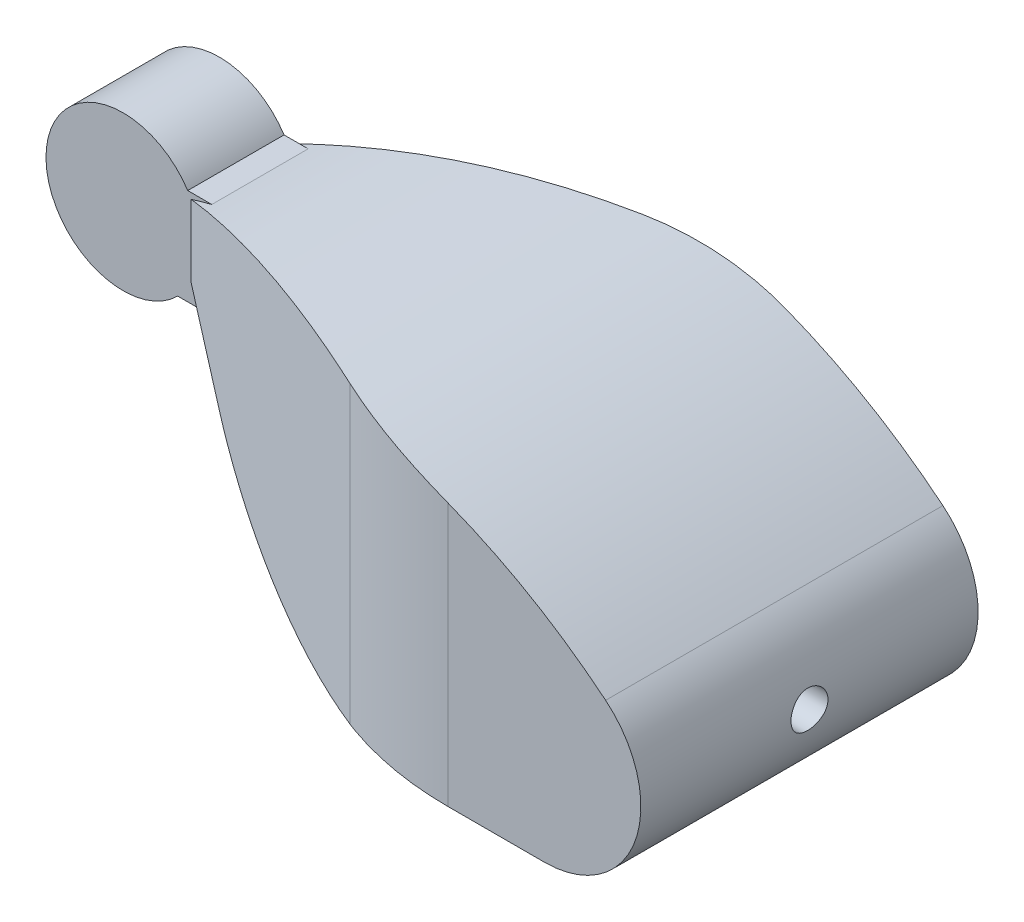
from build123d import *

# Parameters (mm, degrees)
BOSS_EXTRUDE1_DEPTH             = 6.35
BOSS_EXTRUDE3_START             = -7.9375
BOSS_EXTRUDE3_DEPTH             = 22.225
CUT_EXTRUDE4_DEPTH              = 48.173062372
CUT_EXTRUDE4_DEPTH_BACK         = 48.173062372
CUT_EXTRUDE10_START             = -19.05
SKETCH16_W                      = 4.7625
SKETCH16_H                      = 4.7625
CUT_EXTRUDE10_DEPTH             = 33.703711112
CUT_EXTRUDE11_REACH             = 48.31
CUT_EXTRUDE11_DIRECTION_2_REACH = 48.31
F_2_CLEARANCE_HOLE1_D           = 2.4384
BOSS_EXTRUDE19_START            = -6.35
BOSS_EXTRUDE19_DEPTH            = 6.35
CUT_EXTRUDE12_DEPTH             = 4.7625
CUT_EXTRUDE12_DEPTH_BACK        = 4.7625
CUT_EXTRUDE13_DEPTH             = 3.175
CUT_EXTRUDE14_START             = 9.525
CUT_EXTRUDE14_DEPTH             = 3.175


with BuildPart() as part:
    # Sketch2 → Boss-Extrude1 (new body)
    with BuildSketch(Plane.XY):
        with BuildLine():
            Line((4.487320853, -2.38125), (4.487320853, 2.38125))
            ThreePointArc((4.487320853, 2.38125), (-5.08, 0), (4.487320853, -2.38125))
        make_face()
    extrude(amount=BOSS_EXTRUDE1_DEPTH)

    # Sketch3 → Boss-Extrude3 (add)
    with BuildSketch(Plane.XY.offset(BOSS_EXTRUDE3_START)):
        with BuildLine():
            Line((4.487320853, 2.38125), (4.487320853, -2.38125))
            Line((4.487320853, -2.38125), (7.464780529, -7.539384784))
            ThreePointArc((7.464780529, -7.539384784), (13.566062361, -13.641452925), (21.901057446, -15.875))
            Line((21.901057446, -15.875), (35.711259281, -15.875))
            ThreePointArc((35.711259281, -15.875), (41.690195135, -11.663884303), (39.7390552, -4.615890098))
            ThreePointArc((39.7390552, -4.615890098), (22.990060642, 3.300382048), (4.487320853, 2.38125))
        make_face()
    extrude(amount=BOSS_EXTRUDE3_DEPTH)

    # Sketch14 → Cut-Extrude4 (cut, two sides: drawn at the far end of the back side and taken through both)
    with BuildSketch(Plane(origin=(0, 0, 0), x_dir=(1, 0, 0), z_dir=(0, 1, 0)).offset(-CUT_EXTRUDE4_DEPTH_BACK)):
        with BuildLine():
            Line((4.487320853, -6.35), (21.428093277, -12.823412845))
            ThreePointArc((21.428093277, -12.823412845), (25.327691566, -13.918413536), (29.361259281, -14.2875))
            Line((29.361259281, -14.2875), (4.487320853, -14.2875))
            Line((4.487320853, -14.2875), (4.487320853, -6.35))
        make_face()
        with BuildLine():
            Line((4.487320853, 0), (21.428093277, 6.473412845))
            ThreePointArc((21.428093277, 6.473412845), (25.327691566, 7.568413536), (29.361259281, 7.9375))
            Line((29.361259281, 7.9375), (4.487320853, 7.9375))
            Line((4.487320853, 7.9375), (4.487320853, 0))
        make_face()
    extrude(amount=CUT_EXTRUDE4_DEPTH + CUT_EXTRUDE4_DEPTH_BACK, mode=Mode.SUBTRACT)

    # Sketch16 → Cut-Extrude10 (cut, through all)
    with BuildSketch(Plane(origin=(42.061259281, 0, 0), x_dir=(0, 0, -1), z_dir=(1, 0, 0)).offset(CUT_EXTRUDE10_START)):
        with Locations((-3.175, -9.58215)):
            Rectangle(SKETCH16_W, SKETCH16_H)
    extrude(amount=-CUT_EXTRUDE10_DEPTH, mode=Mode.SUBTRACT)

    # Cut-Extrude11: up to this face of the body (flat: up to its plane)
    cut_extrude11_end = Plane(part.part.faces().sort_by_distance((15.949219939, -9.473187723, 5.55625))[0])
    # Sketch29 → Cut-Extrude11 (cut, up to the picked face)
    with BuildSketch(Plane(origin=(0, 0, 3.175), x_dir=(-1, 0, 0), z_dir=(0, 0, -1)), mode=Mode.PRIVATE) as cut_extrude11_sk1:
        Polygon((-7.269395019, -7.2009), (-23.011259281, -7.2009), (-6.432122374, -5.75041347), align=None)
    cut_extrude11_tool1 = split(extrude(cut_extrude11_sk1.sketch, amount=-CUT_EXTRUDE11_REACH, mode=Mode.PRIVATE), bisect_by=cut_extrude11_end, keep=Keep.BOTH, mode=Mode.PRIVATE)
    # Sketch29 → Cut-Extrude11 (cut, up to the picked face)
    with BuildSketch(Plane(origin=(0, 0, 3.175), x_dir=(-1, 0, 0), z_dir=(0, 0, -1)), mode=Mode.PRIVATE) as cut_extrude11_sk2:
        with BuildLine():
            Line((-23.011259281, -11.9634), (-13.549349632, -13.63178996))
            ThreePointArc((-13.549349632, -13.63178996), (-12.324513592, -12.849454696), (-11.172481099, -11.9634))
            Line((-11.172481099, -11.9634), (-23.011259281, -11.9634))
        make_face()
    cut_extrude11_tool2 = split(extrude(cut_extrude11_sk2.sketch, amount=-CUT_EXTRUDE11_REACH, mode=Mode.PRIVATE), bisect_by=cut_extrude11_end, keep=Keep.BOTH, mode=Mode.PRIVATE)
    add(cut_extrude11_tool1.solids().sort_by(Axis((12.237592, -6.717404, 3.175), (0, 0, 1)))[0], mode=Mode.SUBTRACT)
    add(cut_extrude11_tool2.solids().sort_by(Axis((15.867281, -12.523197, 3.175), (0, 0, 1)))[0], mode=Mode.SUBTRACT)

    # Cut-Extrude11 direction 2: up to this face of the body (flat: up to its plane)
    cut_extrude11_direction_2_end = Plane(part.part.faces().sort_by_distance((15.949219939, -9.473187723, 0.79375))[0])
    # Sketch29 → Cut-Extrude11 direction 2 (cut, up to the picked face)
    with BuildSketch(Plane(origin=(0, 0, 3.175), x_dir=(-1, 0, 0), z_dir=(0, 0, -1)), mode=Mode.PRIVATE) as cut_extrude11_direction_2_sk1:
        Polygon((-7.269395019, -7.2009), (-23.011259281, -7.2009), (-6.432122374, -5.75041347), align=None)
    cut_extrude11_direction_2_tool1 = split(extrude(cut_extrude11_direction_2_sk1.sketch, amount=CUT_EXTRUDE11_DIRECTION_2_REACH, mode=Mode.PRIVATE), bisect_by=cut_extrude11_direction_2_end, keep=Keep.BOTH, mode=Mode.PRIVATE)
    # Sketch29 → Cut-Extrude11 direction 2 (cut, up to the picked face)
    with BuildSketch(Plane(origin=(0, 0, 3.175), x_dir=(-1, 0, 0), z_dir=(0, 0, -1)), mode=Mode.PRIVATE) as cut_extrude11_direction_2_sk2:
        with BuildLine():
            Line((-23.011259281, -11.9634), (-13.549349632, -13.63178996))
            ThreePointArc((-13.549349632, -13.63178996), (-12.324513592, -12.849454696), (-11.172481099, -11.9634))
            Line((-11.172481099, -11.9634), (-23.011259281, -11.9634))
        make_face()
    cut_extrude11_direction_2_tool2 = split(extrude(cut_extrude11_direction_2_sk2.sketch, amount=CUT_EXTRUDE11_DIRECTION_2_REACH, mode=Mode.PRIVATE), bisect_by=cut_extrude11_direction_2_end, keep=Keep.BOTH, mode=Mode.PRIVATE)
    add(cut_extrude11_direction_2_tool1.solids().sort_by(Axis((12.237592, -6.717404, 3.175), (0, 0, -1)))[0], mode=Mode.SUBTRACT)
    add(cut_extrude11_direction_2_tool2.solids().sort_by(Axis((15.867281, -12.523197, 3.175), (0, 0, -1)))[0], mode=Mode.SUBTRACT)

    # #2 Clearance Hole1 (through all)
    with Locations(Plane.ZY.offset(-23.011259281)):
        with Locations((3.175, -9.58215)):
            Hole(F_2_CLEARANCE_HOLE1_D / 2)

    # Sketch25 → Boss-Extrude19 (add)
    with BuildSketch(Plane.XY.offset(6.35).offset(BOSS_EXTRUDE19_START)):
        with BuildLine():
            Line((5.183826817, -3.587873106), (4.487320853, -2.38125))
            ThreePointArc((4.487320853, -2.38125), (4.086603081, -3.017627422), (3.596326817, -3.587873106))
            Line((3.596326817, -3.587873106), (5.183826817, -3.587873106))
        make_face()
        with BuildLine():
            Line((4.259998652, 2.767455779), (5.847498652, 2.767455779))
            ThreePointArc((5.847498652, 2.767455779), (5.165618018, 2.580663195), (4.487320853, 2.38125))
            ThreePointArc((4.487320853, 2.38125), (4.377920551, 2.576860812), (4.259998652, 2.767455779))
        make_face()
    extrude(amount=BOSS_EXTRUDE19_DEPTH)

    # Sketch32 → Cut-Extrude12 (cut, two sides: drawn at the far end of the back side and taken through both)
    with BuildSketch(Plane(origin=(0, 0, 3.175), x_dir=(-1, 0, 0), z_dir=(0, 0, -1)).offset(-CUT_EXTRUDE12_DEPTH_BACK)):
        with BuildLine():
            Line((-29.361259281, -15.875), (-21.901057446, -15.875))
            ThreePointArc((-21.901057446, -15.875), (-21.664551554, -15.873322074), (-21.428093277, -15.868288634))
            ThreePointArc((-21.428093277, -15.868288634), (-17.349223696, -15.24146238), (-13.549349632, -13.63178996))
            Line((-13.549349632, -13.63178996), (-16.19315137, -13.165616382))
            ThreePointArc((-16.19315137, -13.165616382), (-18.992500475, -14.004371432), (-21.901057446, -14.2875))
            Line((-21.901057446, -14.2875), (-35.711259281, -14.2875))
            ThreePointArc((-35.711259281, -14.2875), (-37.533789128, -13.924976274), (-39.078855326, -12.892596045))
            Line((-39.078855326, -12.892596045), (-40.201387342, -14.015128061))
            ThreePointArc((-40.201387342, -14.015128061), (-38.141299077, -15.391635031), (-35.711259281, -15.875))
            Line((-35.711259281, -15.875), (-29.361259281, -15.875))
        make_face()
    extrude(amount=CUT_EXTRUDE12_DEPTH + CUT_EXTRUDE12_DEPTH_BACK, mode=Mode.SUBTRACT)

    # Sketch33 → Cut-Extrude13 (cut)
    with BuildSketch(Plane(origin=(0, 0, 7.9375), x_dir=(-1, 0, 0), z_dir=(0, 0, -1))):
        with BuildLine():
            Line((-21.901057446, -15.875), (-21.901057446, -14.2875))
            Line((-21.901057446, -14.2875), (-35.711259281, -14.2875))
            ThreePointArc((-35.711259281, -14.2875), (-37.533789128, -13.924976274), (-39.078855326, -12.892596045))
            Line((-39.078855326, -12.892596045), (-40.201387342, -14.015128061))
            ThreePointArc((-40.201387342, -14.015128061), (-38.141299077, -15.391635031), (-35.711259281, -15.875))
            Line((-35.711259281, -15.875), (-21.901057446, -15.875))
        make_face()
    extrude(amount=-CUT_EXTRUDE13_DEPTH, mode=Mode.SUBTRACT)

    # Sketch33<2> → Cut-Extrude14 (cut)
    with BuildSketch(Plane(origin=(0, 0, 7.9375), x_dir=(-1, 0, 0), z_dir=(0, 0, -1)).offset(CUT_EXTRUDE14_START)):
        with BuildLine():
            Line((-35.711259281, -15.875), (-21.901057446, -15.875))
            Line((-21.901057446, -15.875), (-21.901057446, -14.2875))
            Line((-21.901057446, -14.2875), (-35.711259281, -14.2875))
            ThreePointArc((-35.711259281, -14.2875), (-37.533789128, -13.924976274), (-39.078855326, -12.892596045))
            Line((-39.078855326, -12.892596045), (-40.201387342, -14.015128061))
            ThreePointArc((-40.201387342, -14.015128061), (-38.141299077, -15.391635031), (-35.711259281, -15.875))
        make_face()
    extrude(amount=CUT_EXTRUDE14_DEPTH, mode=Mode.SUBTRACT)


solid = part.part
